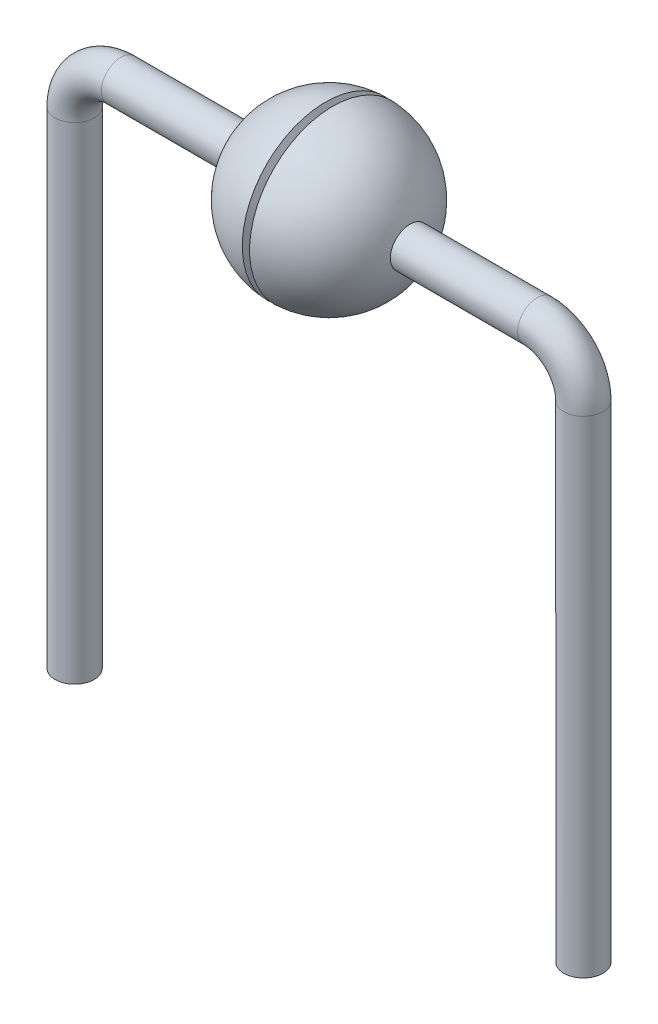
from build123d import *

# Parameters (mm, degrees)
SKETCH_3_R = 0.423054932


with BuildPart() as part:
    # Эскиз1 → Повернуть2 (revolve)
    with BuildSketch(Plane(origin=(0, 0, 0), x_dir=(1, 0, 0), z_dir=(0, 1, 0))):
        with BuildLine():
            Line((-1.749578385, 0.423054932), (-1.749578385, 0))
            Line((-1.749578385, 0), (1.749578385, 0))
            Line((1.749578385, 0), (1.749578385, 0.423054932))
            ThreePointArc((1.749578385, 0.423054932), (1.144753012, 1.389079027), (0.080960724, 1.798178345))
            Line((0.080960724, 1.798178345), (0, 1.645856706))
            Line((0, 1.645856706), (-0.075759465, 1.798404989))
            ThreePointArc((-0.075759465, 1.798404989), (-1.142742977, 1.390733076), (-1.749578385, 0.423054932))
        make_face()
    revolve(axis=Axis((-29.751182373, 0, 0), (1, 0, 0)))

    # По траектории1: sweep along a path in Эскиз2
    with BuildLine(Plane.XY) as sweep_1_path:
        Line((0, 0), (-4.5, 0))
        ThreePointArc((-4.5, 0), (-5.207106781, -0.292893219), (-5.5, -1))
        Line((-5.5, -1), (-5.5, -11.514871198))
    # Эскиз3 → По траектории1 (sweep)
    with BuildSketch(Plane.ZY.offset(1.749578385)):
        Circle(SKETCH_3_R)
    sweep_1 = sweep(path=sweep_1_path.line)

    # Зеркальное отражение1: По траектории1 across plane
    add(sweep_1.mirror(Plane(origin=(0, 0, 0), x_dir=(0, 0, 1), z_dir=(1, 0, 0))))


solid = part.part
